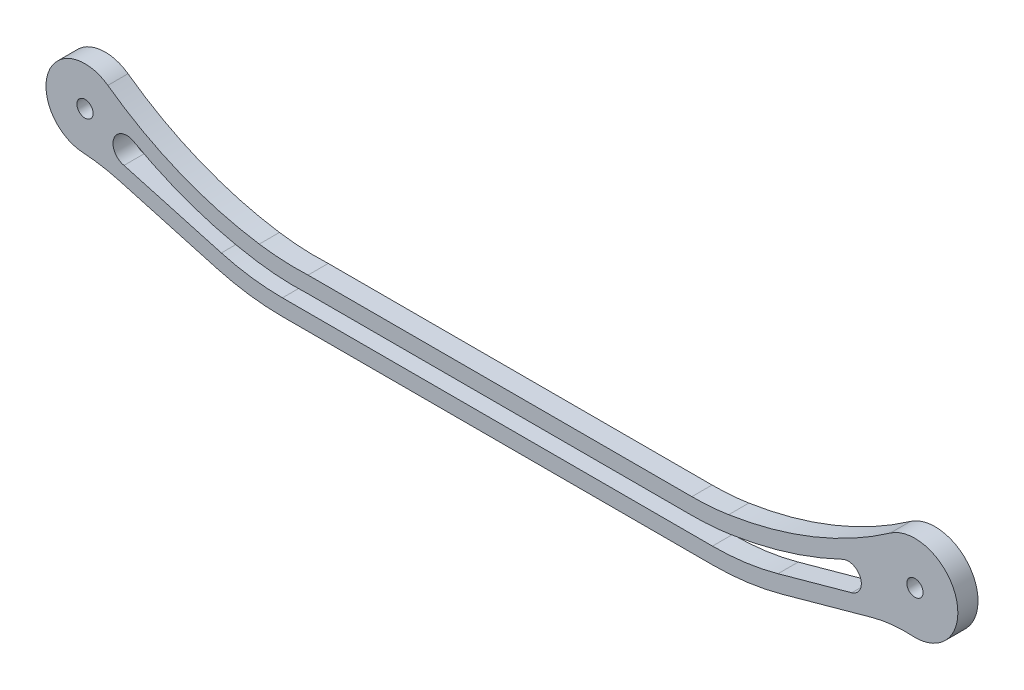
from build123d import *

# Parameters (mm, degrees)
SKETCH1_R           = 2.5
BOSS_EXTRUDE1_DEPTH = 6.2


with BuildPart() as part:
    # Sketch1 → Boss-Extrude1 (new body)
    with BuildSketch(Plane.XY):
        with BuildLine():
            ThreePointArc((-128.349445963, -11.974982784), (-122.593742509, -12.647675527), (-116.938372425, -13.911569107))
            Line((-116.938372425, -13.911569107), (-87, -22.25))
            ThreePointArc((-87, -22.25), (-77.031989093, -24.309319739), (-66.876941087, -25))
            Line((-66.876941087, -25), (65.326528755, -25))
            ThreePointArc((65.326528755, -25), (76.171142315, -24.268371831), (86.819214247, -22.086746937))
            Line((86.819214247, -22.086746937), (114.2908591, -14.5))
            ThreePointArc((114.2908591, -14.5), (120.491041615, -13.324280476), (126.8, -13.177230394))
            ThreePointArc((126.8, -13.177230394), (140.274563377, 3.600104754), (120, 10.810161116))
            ThreePointArc((120, 10.810161116), (96.313236011, -2.023267975), (70.328890052, -9.134769615))
            ThreePointArc((70.328890052, -9.134769615), (64.680941239, -9.783377892), (59, -10))
            Line((59, -10), (-59, -10))
            ThreePointArc((-59, -10), (-66.518658645, -9.998172905), (-74, -9.25))
            ThreePointArc((-74, -9.25), (-98.410939741, -2.539404949), (-120.554503776, 9.732051233))
            ThreePointArc((-120.554503776, 9.732051233), (-138.868880222, 4.055609252), (-128.349445963, -11.974982784))
        make_face()
        with BuildLine():
            Line((-85.658462739, -17.433333333), (-115.596835164, -9.09490244))
            ThreePointArc((-115.596835164, -9.09490244), (-118.701610917, -3.444269215), (-112.647605232, -1.22654437))
            ThreePointArc((-112.647605232, -1.22654437), (-94.281848906, -9.423130627), (-74.744170673, -14.194310873))
            ThreePointArc((-74.744170673, -14.194310873), (-66.831109196, -14.988771962), (-58.878274211, -15))
            Line((-58.878274211, -15), (59, -15))
            ThreePointArc((59, -15), (65.061701375, -14.768858984), (71.088199037, -14.076778302))
            ThreePointArc((71.088199037, -14.076778302), (88.608020432, -10.052780957), (105.35190821, -3.512221467))
            ThreePointArc((105.35190821, -3.512221467), (110.845938526, -5.730539831), (108.152661113, -11.007997765))
            Line((108.152661113, -11.007997765), (85.488206013, -17.26716012))
            ThreePointArc((85.488206013, -17.26716012), (75.499552441, -19.313680413), (65.326528755, -20))
            Line((65.326528755, -20), (-66.876941087, -20))
            ThreePointArc((-66.876941087, -20), (-76.354985893, -19.355365089), (-85.658462739, -17.433333333))
        make_face(mode=Mode.SUBTRACT)
        with Locations(Location((-127.574986581, 0, 0), (0, 0, 180))):
            Circle(SKETCH1_R, mode=Mode.SUBTRACT)
        with Locations(Location((127.574986581, 0, 0), (0, 0, 180))):
            Circle(SKETCH1_R, mode=Mode.SUBTRACT)
    extrude(amount=BOSS_EXTRUDE1_DEPTH)


solid = part.part
